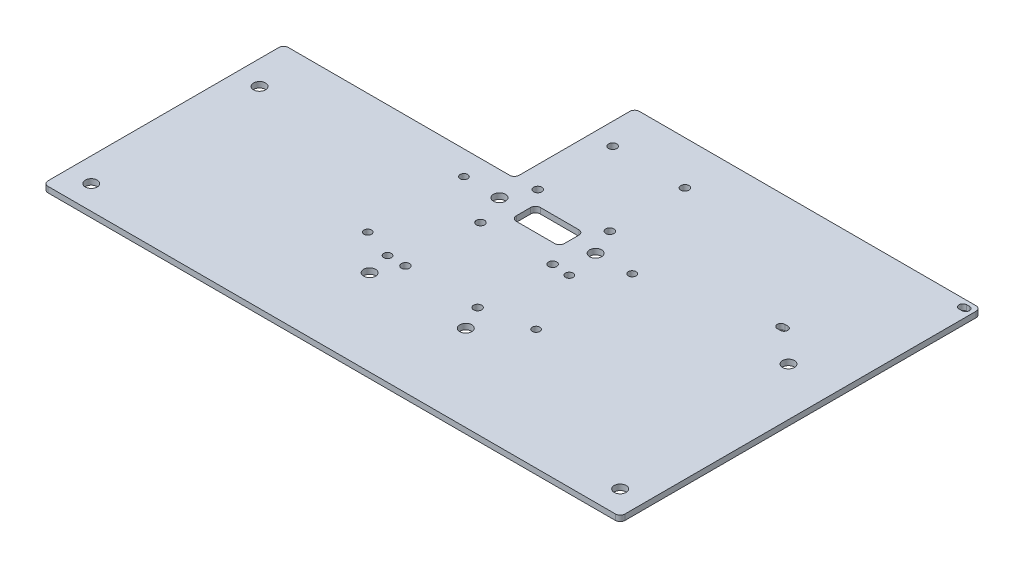
from build123d import *

# Parameters (mm, degrees)
SKETCH1_R           = 2.15
BOSS_EXTRUDE1_DEPTH = 3
SKETCH2_R           = 2
CUT_EXTRUDE1_DEPTH  = 289.872749062
SKETCH3_R           = 3.175
CUT_EXTRUDE2_DEPTH  = 289.872749062
SKETCH4_W           = 127
SKETCH4_H           = 64.740069581
CUT_EXTRUDE3_DEPTH  = 289.872749062
SKETCH5_W           = 304.8
SKETCH5_H           = 67.289955289
CUT_EXTRUDE4_DEPTH  = 289.872749062
SKETCH6_R           = 2
CUT_EXTRUDE5_DEPTH  = 260.625171507
SKETCH7_R           = 3.175
CUT_EXTRUDE6_DEPTH  = 260.625171507
CUT_EXTRUDE7_DEPTH  = 260.625171507
FILLET1_R           = 2.54
FILLET2_R           = 2.54


with BuildPart() as part:
    # Sketch1 → Boss-Extrude1 (new body)
    with BuildSketch(Plane(origin=(0, 0, 0), x_dir=(1, 0, 0), z_dir=(0, 1, 0))):
        with BuildLine():
            Line((-126.953423408, -0.978024545), (172.766576592, -0.978024545))
            ThreePointArc((172.766576592, -0.978024545), (174.562627816, -1.721973321), (175.306576592, -3.518024545))
            Line((175.306576592, -3.518024545), (175.306576592, -227.038024545))
            ThreePointArc((175.306576592, -227.038024545), (174.562627816, -228.834075769), (172.766576592, -229.578024545))
            Line((172.766576592, -229.578024545), (-126.953423408, -229.578024545))
            ThreePointArc((-126.953423408, -229.578024545), (-128.749474632, -228.834075769), (-129.493423408, -227.038024545))
            Line((-129.493423408, -227.038024545), (-129.493423408, -3.518024545))
            ThreePointArc((-129.493423408, -3.518024545), (-128.749474632, -1.721973321), (-126.953423408, -0.978024545))
        make_face()
        with Locations(Location((3.856576592, -23.978144226, 0), (0, 0, 270))):
            Circle(SKETCH1_R, mode=Mode.SUBTRACT)
        with Locations(Location((41.956576592, -23.978144226, 0), (0, 0, 270))):
            Circle(SKETCH1_R, mode=Mode.SUBTRACT)
        with Locations(Location((3.856576592, -63.602144226, 0), (0, 0, 270))):
            Circle(SKETCH1_R, mode=Mode.SUBTRACT)
        with Locations(Location((41.956576592, -63.602144226, 0), (0, 0, 270))):
            Circle(SKETCH1_R, mode=Mode.SUBTRACT)
        with Locations(Location((3.856576592, -93.828144226, 0), (0, 0, 270))):
            Circle(SKETCH1_R, mode=Mode.SUBTRACT)
        with Locations(Location((41.956576592, -93.828144226, 0), (0, 0, 270))):
            Circle(SKETCH1_R, mode=Mode.SUBTRACT)
        with Locations(Location((3.856576592, -133.452144226, 0), (0, 0, 270))):
            Circle(SKETCH1_R, mode=Mode.SUBTRACT)
        with Locations(Location((41.956576592, -133.452144226, 0), (0, 0, 270))):
            Circle(SKETCH1_R, mode=Mode.SUBTRACT)
    extrude(amount=BOSS_EXTRUDE1_DEPTH)

    # Sketch2 → Cut-Extrude1 (cut, through all)
    with BuildSketch(Plane(origin=(0, 0, 0), x_dir=(-1, 0, 0), z_dir=(0, -1, 0))):
        with Locations(Location((21.543423408, -77.178024545, 0), (0, 0, 90))):
            Circle(SKETCH2_R)
        with Locations(Location((-67.356576592, -77.178024545, 0), (0, 0, 270))):
            Circle(SKETCH2_R)
        with Locations(Location((21.543423408, -127.978024545, 0), (0, 0, 270))):
            Circle(SKETCH2_R)
        with Locations(Location((-67.356576592, -127.978024545, 0), (0, 0, 90))):
            Circle(SKETCH2_R)
    extrude(amount=-CUT_EXTRUDE1_DEPTH, mode=Mode.SUBTRACT)

    # Sketch3 → Cut-Extrude2 (cut, through all)
    with BuildSketch(Plane(origin=(0, 0, 0), x_dir=(-1, 0, 0), z_dir=(0, -1, 0))):
        with Locations(Location((-48.306576592, -77.456208611, 0), (0, 0, 90))):
            Circle(SKETCH3_R)
        with Locations(Location((2.493423408, -77.456208611, 0), (0, 0, 90))):
            Circle(SKETCH3_R)
        with Locations(Location((2.493423408, -146.036208611, 0), (0, 0, 90))):
            Circle(SKETCH3_R)
        with Locations(Location((-48.306576592, -146.036208611, 0), (0, 0, 90))):
            Circle(SKETCH3_R)
    extrude(amount=-CUT_EXTRUDE2_DEPTH, mode=Mode.SUBTRACT)

    # Sketch4 → Cut-Extrude3 (cut, through all)
    with BuildSketch(Plane.XZ):
        with Locations((-71.073423408, 32.107989755)):
            Rectangle(SKETCH4_W, SKETCH4_H)
    extrude(amount=-CUT_EXTRUDE3_DEPTH, mode=Mode.SUBTRACT)

    # Sketch5 → Cut-Extrude4 (cut, through all)
    with BuildSketch(Plane.XZ):
        with Locations((22.906576592, 225.12300219)):
            Rectangle(SKETCH5_W, SKETCH5_H)
    extrude(amount=-CUT_EXTRUDE4_DEPTH, mode=Mode.SUBTRACT)

    # Sketch6 → Cut-Extrude5 (cut, through all)
    with BuildSketch(Plane(origin=(0, 0, 0), x_dir=(-1, 0, 0), z_dir=(0, -1, 0))):
        with Locations(Location((5.608304381, -133.452144226, 0), (0, 0, 90))):
            Circle(SKETCH6_R)
        with Locations(Location((-51.406576592, -94.452144226, 0), (0, 0, 90))):
            Circle(SKETCH6_R)
        with BuildLine():
            Line((-171.306576592, -2.978024545), (-169.806576592, -2.978024545))
            ThreePointArc((-169.806576592, -2.978024545), (-167.806576592, -4.978024545), (-169.806576592, -6.978024545))
            Line((-169.806576592, -6.978024545), (-171.306576592, -6.978024545))
            ThreePointArc((-171.306576592, -6.978024545), (-173.306576592, -4.978024545), (-171.306576592, -2.978024545))
        make_face()
        with BuildLine():
            Line((-132.356576592, -59.978024545), (-130.806576592, -59.978024545))
            ThreePointArc((-130.806576592, -59.978024545), (-128.806576592, -61.978024545), (-130.806576592, -63.978024545))
            Line((-130.806576592, -63.978024545), (-132.356576592, -63.978024545))
            ThreePointArc((-132.356576592, -63.978024545), (-134.356576592, -61.978024545), (-132.356576592, -59.978024545))
        make_face()
    extrude(amount=-CUT_EXTRUDE5_DEPTH, mode=Mode.SUBTRACT)

    # Sketch7 → Cut-Extrude6 (cut, through all)
    with BuildSketch(Plane.XZ):
        with Locations(Location((149.906576592, 77.178024545, 0), (0, 0, 270))):
            Circle(SKETCH7_R)
        with Locations(Location((-116.793423408, 89.878024545, 0), (0, 0, 270))):
            Circle(SKETCH7_R)
        with Locations(Location((-116.793423408, 178.778024545, 0), (0, 0, 270))):
            Circle(SKETCH7_R)
        with Locations(Location((162.606576592, 178.778024545, 0), (0, 0, 270))):
            Circle(SKETCH7_R)
    extrude(amount=-CUT_EXTRUDE6_DEPTH, mode=Mode.SUBTRACT)

    # Sketch8 → Cut-Extrude7 (cut, through all)
    with BuildSketch(Plane(origin=(0, 0, 0), x_dir=(-1, 0, 0), z_dir=(0, -1, 0))):
        with BuildLine():
            Line((-12.746576592, -83.806208611), (-33.066576592, -83.806208611))
            ThreePointArc((-33.066576592, -83.806208611), (-34.862627816, -83.062259835), (-35.606576592, -81.266208611))
            Line((-35.606576592, -81.266208611), (-35.606576592, -73.646208611))
            ThreePointArc((-35.606576592, -73.646208611), (-34.862627816, -71.850157387), (-33.066576592, -71.106208611))
            Line((-33.066576592, -71.106208611), (-12.746576592, -71.106208611))
            ThreePointArc((-12.746576592, -71.106208611), (-10.950525368, -71.850157387), (-10.206576592, -73.646208611))
            Line((-10.206576592, -73.646208611), (-10.206576592, -81.266208611))
            ThreePointArc((-10.206576592, -81.266208611), (-10.950525368, -83.062259835), (-12.746576592, -83.806208611))
        make_face()
    extrude(amount=-CUT_EXTRUDE7_DEPTH, mode=Mode.SUBTRACT)

    # Fillet1
    fillet1_edges = [part.edges().sort_by_distance(p)[0] for p in [
        (175.306576592, 1.5, 191.478024545),
        (-129.493423408, 1.5, 191.478024545),
    ]]
    fillet(fillet1_edges, radius=FILLET1_R)

    # Fillet2
    fillet2_edges = [part.edges().sort_by_distance(p)[0] for p in [
        (-7.573423408, 1.5, 64.478024545),
        (-129.493423408, 1.5, 64.478024545),
        (-7.573423408, 1.5, 0.978024545),
    ]]
    fillet(fillet2_edges, radius=FILLET2_R)


solid = part.part
